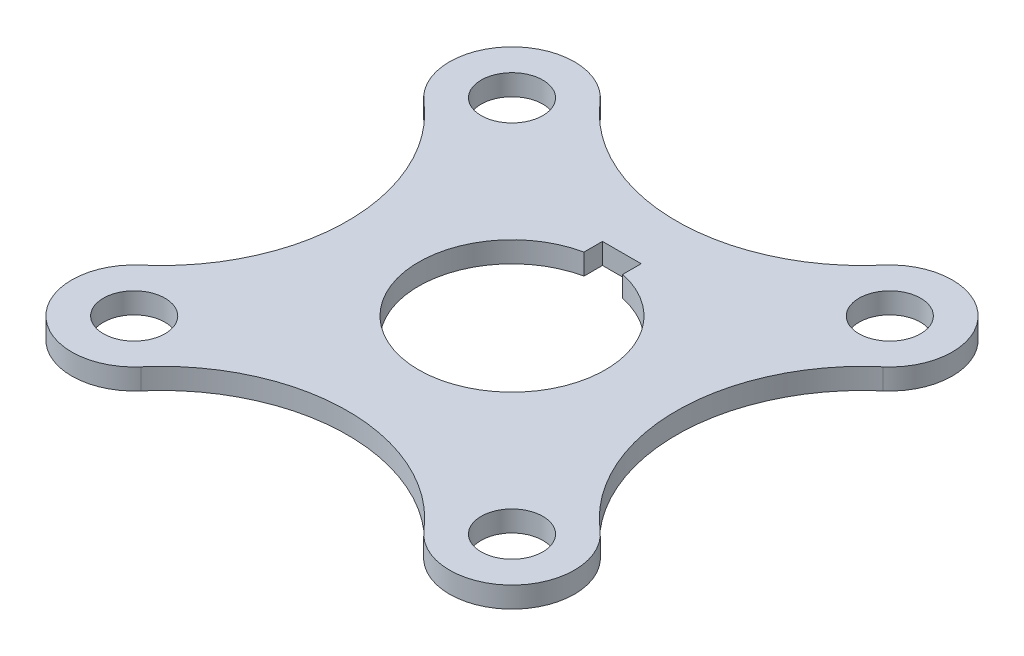
from build123d import *

# Parameters (mm, degrees)
SKETCH1_R           = 2.6
BOSS_EXTRUDE1_DEPTH = 2.54
SKETCH2_R           = 3.75
SKETCH2_R_2         = 2.6
CUT_EXTRUDE1_DEPTH  = 44.322547245


with BuildPart() as part:
    # Sketch1 → Boss-Extrude1 (new body)
    with BuildSketch(Plane(origin=(0, 0, 0), x_dir=(1, 0, 0), z_dir=(0, 1, 0))):
        with BuildLine():
            ThreePointArc((-17.206636662, 27.922333563), (-28.354981926, 28.354981926), (-27.922333563, 17.206636662))
            ThreePointArc((-27.922333563, 17.206636662), (-20, 0), (-27.922333563, -17.206636662))
            ThreePointArc((-27.922333563, -17.206636662), (-28.354981926, -28.354981926), (-17.206636662, -27.922333563))
            ThreePointArc((-17.206636662, -27.922333563), (0, -20), (17.206636662, -27.922333563))
            ThreePointArc((17.206636662, -27.922333563), (28.354981926, -28.354981926), (27.922333563, -17.206636662))
            ThreePointArc((27.922333563, -17.206636662), (20, 0), (27.922333563, 17.206636662))
            ThreePointArc((27.922333563, 17.206636662), (28.354981926, 28.354981926), (17.206636662, 27.922333563))
            ThreePointArc((17.206636662, 27.922333563), (0, 20), (-17.206636662, 27.922333563))
        make_face()
        with Locations(Location((22.980970389, 22.980970389, 0), (0, 0, 270))):
            Circle(SKETCH1_R, mode=Mode.SUBTRACT)
        with Locations(Location((22.980970389, -22.980970389, 0), (0, 0, 270))):
            Circle(SKETCH1_R, mode=Mode.SUBTRACT)
        with Locations(Location((-22.980970389, -22.980970389, 0), (0, 0, 270))):
            Circle(SKETCH1_R, mode=Mode.SUBTRACT)
        with Locations(Location((-22.980970389, 22.980970389, 0), (0, 0, 270))):
            Circle(SKETCH1_R, mode=Mode.SUBTRACT)
        with BuildLine():
            Line((2.353261567, 13.359444444), (-2.353261567, 13.359444444))
            Line((-2.353261567, 13.359444444), (-2.353261567, 11.113016606))
            ThreePointArc((-2.353261567, 11.113016606), (0, -11.359444444), (2.353261567, 11.113016606))
            Line((2.353261567, 11.113016606), (2.353261567, 13.359444444))
        make_face(mode=Mode.SUBTRACT)
    extrude(amount=BOSS_EXTRUDE1_DEPTH)

    # Sketch2 → Cut-Extrude1 (cut, through all)
    # profile 1 of 4: a face of its own
    with BuildSketch(Plane(origin=(0, 2.54, 0), x_dir=(1, 0, 0), z_dir=(0, 1, 0))):
        with Locations(Location((-22.980970389, 22.980970389, 0), (0, 0, 270))):
            Circle(SKETCH2_R)
        with Locations((-22.980970389, 22.980970389)):
            Circle(SKETCH2_R_2, mode=Mode.SUBTRACT)
    # profile 2 of 4: a face of its own
    with BuildSketch(Plane(origin=(0, 2.54, 0), x_dir=(1, 0, 0), z_dir=(0, 1, 0))):
        with Locations(Location((22.980970389, 22.980970389, 0), (0, 0, 270))):
            Circle(SKETCH2_R)
        with Locations((22.980970389, 22.980970389)):
            Circle(SKETCH2_R_2, mode=Mode.SUBTRACT)
    # profile 3 of 4: a face of its own
    with BuildSketch(Plane(origin=(0, 2.54, 0), x_dir=(1, 0, 0), z_dir=(0, 1, 0))):
        with Locations(Location((22.980970389, -22.980970389, 0), (0, 0, 270))):
            Circle(SKETCH2_R)
        with Locations((22.980970389, -22.980970389)):
            Circle(SKETCH2_R_2, mode=Mode.SUBTRACT)
    # profile 4 of 4: a face of its own
    with BuildSketch(Plane(origin=(0, 2.54, 0), x_dir=(1, 0, 0), z_dir=(0, 1, 0))):
        with Locations(Location((-22.980970389, -22.980970389, 0), (0, 0, 270))):
            Circle(SKETCH2_R)
        with Locations((-22.980970389, -22.980970389)):
            Circle(SKETCH2_R_2, mode=Mode.SUBTRACT)
    extrude(amount=-CUT_EXTRUDE1_DEPTH, mode=Mode.SUBTRACT)


solid = part.part
